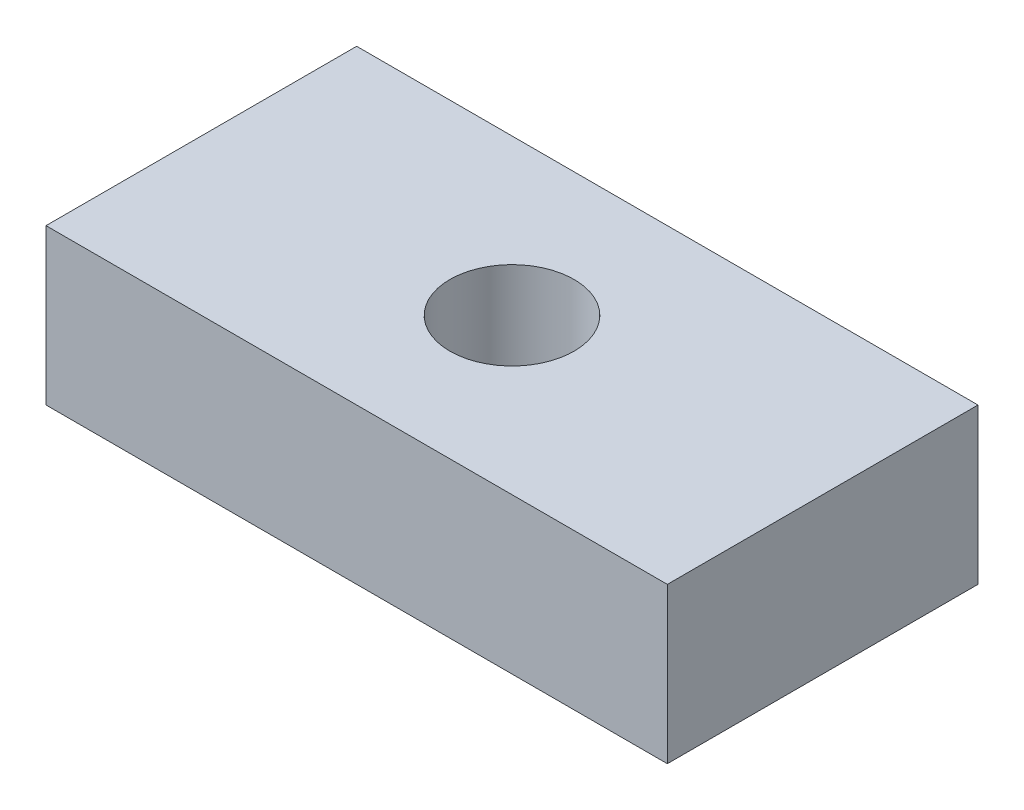
from build123d import *

# Parameters (mm, degrees)
SKETCH2_W           = 40
SKETCH2_H           = 20
BOSS_EXTRUDE1_DEPTH = 10
CUT_EXTRUDE1_REACH  = 52.396
SKETCH3_R           = 4


with BuildPart() as part:
    # Sketch2 → Boss-Extrude1 (new body)
    with BuildSketch(Plane(origin=(0, 0, 0), x_dir=(1, 0, 0), z_dir=(0, 1, 0))):
        with Locations((-16.330703266, -23.463822806)):
            Rectangle(SKETCH2_W, SKETCH2_H)
    extrude(amount=BOSS_EXTRUDE1_DEPTH)

    # Sketch3 → Cut-Extrude1 (cut, up to next)
    with BuildSketch(Plane(origin=(0, 10, 0), x_dir=(1, 0, 0), z_dir=(0, 1, 0)), mode=Mode.PRIVATE) as cut_extrude1_sk1:
        with Locations(Location((-16.330703266, -23.463822806, 0), (0, 0, 270))):
            Circle(SKETCH3_R)
    cut_extrude1_tool1 = extrude(cut_extrude1_sk1.sketch, amount=-CUT_EXTRUDE1_REACH, mode=Mode.PRIVATE) & part.part
    add(cut_extrude1_tool1.solids().sort_by_distance((-16.330703, 10, 23.463823))[0], mode=Mode.SUBTRACT)


solid = part.part
